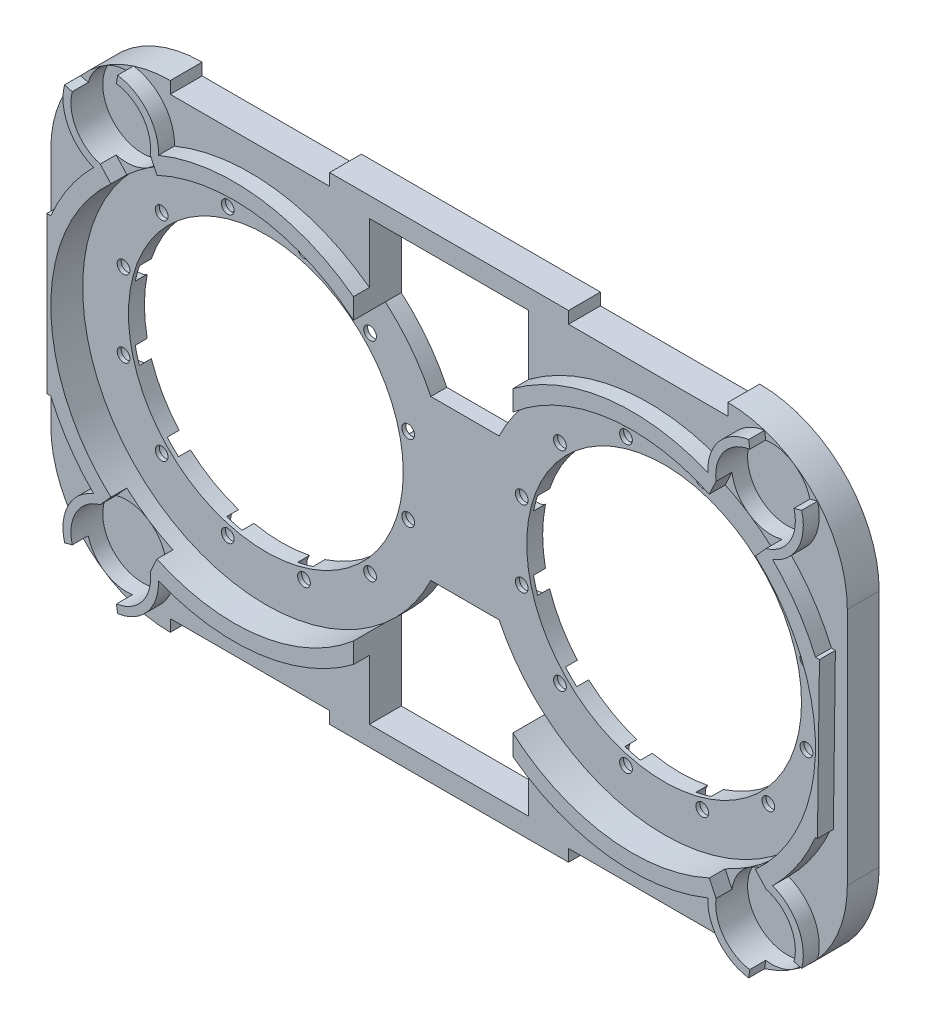
from build123d import *
from build123d.topology import SkipClean

# Parameters (mm, degrees)
SKETCH_1_R                   = 34.5
EXTRUDE_1286_DEPTH           = 4
EXTRUDE_START                = 4
SKETCH_2_R                   = 10
EXTRUDE_1_DEPTH              = 4
CUT_EXTRUDE_1_DEPTH          = 4
CUT_EXTRUDE_1_DEPTH_BACK     = 4
SKETCH_3_W                   = 40
SKETCH_3_H                   = 3
SKETCH_3_H_2                 = 3.124740162
HOLE_WIZARD_M3_2_D           = 3.2
HOLE_WIZARD_M3_2_CBORE_D     = 6.5
HOLE_WIZARD_M3_2_CBORE_DEPTH = 3
EXTRUDE_9_DEPTH              = 4


with BuildPart() as part:
    # 草图1 → Extrude 1286 (new body)
    with BuildSketch(Plane.XY):
        with BuildLine():
            Line((100, -30), (100, 30))
            ThreePointArc((100, 30), (91.213203436, 51.213203436), (70, 60))
            Line((70, 60), (-70, 60))
            ThreePointArc((-70, 60), (-91.213203436, 51.213203436), (-100, 30))
            Line((-100, 30), (-100, -30))
            ThreePointArc((-100, -30), (-91.213203436, -51.213203436), (-70, -60))
            Line((-70, -60), (70, -60))
            ThreePointArc((70, -60), (91.213203436, -51.213203436), (100, -30))
        make_face()
        with BuildLine():
            Line((20, -55), (-20, -55))
            Line((-20, -55), (-20, -34.871191548))
            ThreePointArc((-20, -34.871191548), (-13.521821046, -28.02396225), (-8.575369646, -20))
            Line((-8.575369646, -20), (0, -20))
            Line((0, -20), (8.575369646, -20))
            ThreePointArc((8.575369646, -20), (13.521821046, -28.02396225), (20, -34.871191548))
            Line((20, -34.871191548), (20, -55))
        make_face(mode=Mode.SUBTRACT)
        with Locations((-50, 0)):
            Circle(SKETCH_1_R, mode=Mode.SUBTRACT)
        with Locations((50, 0)):
            Circle(SKETCH_1_R, mode=Mode.SUBTRACT)
        with BuildLine():
            Line((-20, 34.871191548), (-20, 55))
            Line((-20, 55), (20, 55))
            Line((20, 55), (20, 34.871191548))
            ThreePointArc((20, 34.871191548), (13.521821046, 28.02396225), (8.575369646, 20))
            Line((8.575369646, 20), (0, 20))
            Line((0, 20), (-8.575369646, 20))
            ThreePointArc((-8.575369646, 20), (-13.521821046, 28.02396225), (-20, 34.871191548))
        make_face(mode=Mode.SUBTRACT)
    extrude(amount=-EXTRUDE_1286_DEPTH)

    # 草图2 → 凸台-拉伸1 (add)
    with BuildSketch(Plane.XY.offset(EXTRUDE_START)):
        with BuildLine():
            ThreePointArc((-70, 60), (-91.213203436, 51.213203436), (-100, 30))
            Line((-100, 30), (-100, -30))
            ThreePointArc((-100, -30), (-91.213203436, -51.213203436), (-70, -60))
            Line((-70, -60), (70, -60))
            ThreePointArc((70, -60), (91.213203436, -51.213203436), (100, -30))
            Line((100, -30), (100, 30))
            ThreePointArc((100, 30), (91.213203436, 51.213203436), (70, 60))
            Line((70, 60), (-70, 60))
        make_face()
        with Locations((-80.949977087, -46.672125799)):
            Circle(SKETCH_2_R, mode=Mode.SUBTRACT)
        with BuildLine():
            Line((-20, 55), (20, 55))
            Line((20, 55), (20, 34.871191548))
            ThreePointArc((20, 34.871191548), (69.183326093, 41.809089921), (96, 0))
            ThreePointArc((96, 0), (69.183326093, -41.809089921), (20, -34.871191548))
            Line((20, -34.871191548), (20, -55))
            Line((20, -55), (-20, -55))
            Line((-20, -55), (-20, -34.871191548))
            ThreePointArc((-20, -34.871191548), (-96, 0), (-20, 34.871191548))
            Line((-20, 34.871191548), (-20, 55))
        make_face(mode=Mode.SUBTRACT)
        with Locations((80.949977087, -46.672125799)):
            Circle(SKETCH_2_R, mode=Mode.SUBTRACT)
        with Locations((-80.949977087, 46.672125799)):
            Circle(SKETCH_2_R, mode=Mode.SUBTRACT)
        with Locations((80.949977087, 46.672125799)):
            Circle(SKETCH_2_R, mode=Mode.SUBTRACT)
    extrude(amount=-EXTRUDE_1_DEPTH)

    # 草图3 → 切除-拉伸1 (cut, two sides: drawn at the far end of the back side and taken through both)
    with BuildSketch(Plane.XY.offset(-CUT_EXTRUDE_1_DEPTH_BACK)):
        with Locations((-50, -58.5)):
            Rectangle(SKETCH_3_W, SKETCH_3_H)
        with Locations((50, 58.562370081)):
            Rectangle(SKETCH_3_W, SKETCH_3_H_2)
        with Locations((-50, 58.5)):
            Rectangle(SKETCH_3_W, SKETCH_3_H)
        with Locations((50, -58.562370081)):
            Rectangle(SKETCH_3_W, SKETCH_3_H_2)
    extrude(amount=CUT_EXTRUDE_1_DEPTH + CUT_EXTRUDE_1_DEPTH_BACK, mode=Mode.SUBTRACT)

    # M3 六角凹头盖的柱孔2 (through all)
    with Locations(Plane(origin=(76.1629509, 26.1629509, -4), x_dir=(-1, 0, 0), z_dir=(0, 0, -1))):
        with Locations((0, 0), (16.586646231, 9.57630467), (35.739255569, 9.576304673), (52.325901804, 4e-09), (61.902206473, -16.586646231), (61.902206473, -35.739255569), (52.325901804, -52.325901804), (35.739255569, -61.902206473), (-9.57630467, -35.789865232), (-9.57630467, -16.58664623), (16.586646231, -61.902206473), (-4e-09, -52.325901804), (116.586646231, 9.576304673), (135.739255569, 9.576304673), (152.325901804, 4e-09), (161.902206473, -16.586646231), (161.902206473, -35.739255569), (152.325901804, -52.325901804), (135.739255569, -61.902206473), (116.586646231, -61.902206473), (99.999999996, -52.325901804), (90.423695327, -35.739255569), (90.423695327, -16.586646231), (99.999999996, 4e-09)):
            CounterBoreHole(HOLE_WIZARD_M3_2_D / 2, HOLE_WIZARD_M3_2_CBORE_D / 2, HOLE_WIZARD_M3_2_CBORE_DEPTH)

    # 草图7 → 凸台-拉伸9 (add)
    with SkipClean():  # the faces are left unmerged after this step: merging them gives an invalid solid
        with BuildSketch(Plane.XY.offset(4).offset(EXTRUDE_START)):
            with BuildLine():
                Line((-79.222747721, -58.547170166), (-79.510619282, -56.567996105))
                ThreePointArc((-79.510619282, -56.567996105), (-72.973112582, -52.702849858), (-71.036529659, -45.359281519))
                Line((-71.036529659, -45.359281519), (-69.353607287, -41.730538997))
                ThreePointArc((-69.353607287, -41.730538997), (-43.667616459, -45.56205569), (-20, -34.871191548))
                Line((-20, -34.871191548), (-20, -40))
                ThreePointArc((-20, -40), (-43.651226208, -49.595292834), (-68.95681626, -46.267041371))
                ThreePointArc((-68.95681626, -46.267041371), (-71.743312785, -54.368705068), (-79.222747721, -58.547170166))
            make_face()
            with BuildLine():
                Line((-92.533909372, 49.804618866), (-90.603253991, 49.282536688))
                ThreePointArc((-90.603253991, 49.282536688), (-89.631463994, 41.709083881), (-83.59823142, 37.029162095))
                Line((-83.59823142, 37.029162095), (-80.910372906, 34.066829128))
                ThreePointArc((-80.910372906, 34.066829128), (-96, 0), (-80.910372906, -34.066829128))
                Line((-80.910372906, -34.066829128), (-83.59823142, -37.029162095))
                ThreePointArc((-83.59823142, -37.029162095), (-89.631463994, -41.709083881), (-90.603253991, -49.282536688))
                Line((-90.603253991, -49.282536688), (-92.533909372, -49.804618866))
                ThreePointArc((-92.533909372, -49.804618866), (-91.646698387, -41.233361838), (-85.243723779, -35.466603082))
                ThreePointArc((-85.243723779, -35.466603082), (-91.389676552, -28.051642999), (-96, -19.595917942))
                Line((-96, -19.595917942), (-97, -19.595917942))
                Line((-97, -19.595917942), (-97, 19.595917942))
                Line((-97, 19.595917942), (-96, 19.595917942))
                ThreePointArc((-96, 19.595917942), (-91.389676552, 28.051642999), (-85.243723779, 35.466603082))
                ThreePointArc((-85.243723779, 35.466603082), (-91.646698387, 41.233361838), (-92.533909372, 49.804618866))
            make_face()
            with BuildLine():
                Line((-20, 34.871191548), (-20, 40))
                ThreePointArc((-20, 40), (-43.651226208, 49.595292834), (-68.95681626, 46.267041371))
                ThreePointArc((-68.95681626, 46.267041371), (-71.743312785, 54.368705068), (-79.222747721, 58.547170166))
                Line((-79.222747721, 58.547170166), (-79.510619282, 56.567996105))
                ThreePointArc((-79.510619282, 56.567996105), (-72.973112582, 52.702849858), (-71.036529659, 45.359281519))
                Line((-71.036529659, 45.359281519), (-69.353607287, 41.730538997))
                ThreePointArc((-69.353607287, 41.730538997), (-43.667616459, 45.56205569), (-20, 34.871191548))
            make_face()
            with BuildLine():
                Line((79.222747721, 58.547170166), (79.510619282, 56.567996105))
                ThreePointArc((79.510619282, 56.567996105), (72.973112582, 52.702849858), (71.036529659, 45.359281519))
                Line((71.036529659, 45.359281519), (69.353607287, 41.730538997))
                ThreePointArc((69.353607287, 41.730538997), (43.667616459, 45.56205569), (20, 34.871191548))
                Line((20, 34.871191548), (20, 40))
                ThreePointArc((20, 40), (43.651226208, 49.595292834), (68.95681626, 46.267041371))
                ThreePointArc((68.95681626, 46.267041371), (71.743312785, 54.368705068), (79.222747721, 58.547170166))
            make_face()
            with BuildLine():
                Line((83.59823142, 37.029162095), (80.910372906, 34.066829128))
                ThreePointArc((80.910372906, 34.066829128), (96, 0), (80.910372906, -34.066829128))
                Line((80.910372906, -34.066829128), (83.59823142, -37.029162095))
                ThreePointArc((83.59823142, -37.029162095), (89.631463994, -41.709083881), (90.603253991, -49.282536688))
                Line((90.603253991, -49.282536688), (92.533909372, -49.804618866))
                ThreePointArc((92.533909372, -49.804618866), (91.646698387, -41.233361838), (85.243723779, -35.466603082))
                ThreePointArc((85.243723779, -35.466603082), (91.389676552, -28.051642999), (96, -19.595917942))
                Line((96, -19.595917942), (96.5, -19.595917942))
                Line((96.5, -19.595917942), (97, 19.595917942))
                Line((97, 19.595917942), (96, 19.595917942))
                ThreePointArc((96, 19.595917942), (91.389676552, 28.051642999), (85.243723779, 35.466603082))
                ThreePointArc((85.243723779, 35.466603082), (91.646698387, 41.233361838), (92.533909372, 49.804618866))
                Line((92.533909372, 49.804618866), (90.603253991, 49.282536688))
                ThreePointArc((90.603253991, 49.282536688), (89.631463994, 41.709083881), (83.59823142, 37.029162095))
            make_face()
            with BuildLine():
                Line((20, -34.871191548), (20, -40))
                ThreePointArc((20, -40), (43.651226208, -49.595292834), (68.95681626, -46.267041371))
                ThreePointArc((68.95681626, -46.267041371), (71.743312785, -54.368705068), (79.222747721, -58.547170166))
                Line((79.222747721, -58.547170166), (79.510619282, -56.567996105))
                ThreePointArc((79.510619282, -56.567996105), (72.973112582, -52.702849858), (71.036529659, -45.359281519))
                Line((71.036529659, -45.359281519), (69.353607287, -41.730538997))
                ThreePointArc((69.353607287, -41.730538997), (43.667616459, -45.56205569), (20, -34.871191548))
            make_face()
        extrude(amount=-EXTRUDE_9_DEPTH)


solid = part.part
